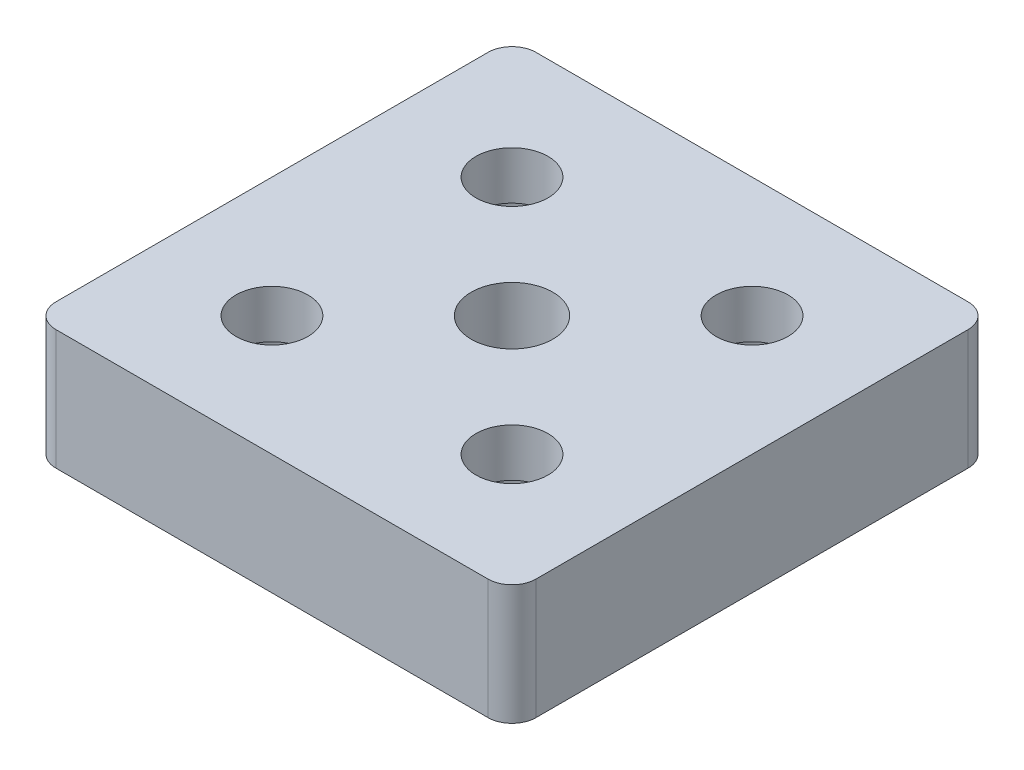
from build123d import *

# Parameters (mm, degrees)
SKETCH_1_R             = 3
EXTRUDE_1_DEPTH        = 10
SKETCH_3_R             = 5.5
CUT_EXTRUDE_1_DEPTH    = 6
HOLE_WIZARD_M8_1_D     = 6.8
HOLE_WIZARD_M8_1_DEPTH = 38.75
HOLE_WIZARD_M8_1_TIP   = 2.042926105


with BuildPart() as part:
    # 草图1 → 凸台-拉伸1 (new body)
    with BuildSketch(Plane(origin=(0, 0, 0), x_dir=(1, 0, 0), z_dir=(0, 1, 0))):
        with BuildLine():
            Line((-18, 0), (18, 0))
            ThreePointArc((18, 0), (19.414213562, 0.585786438), (20, 2))
            Line((20, 2), (20, 38))
            ThreePointArc((20, 38), (19.414213562, 39.414213562), (18, 40))
            Line((18, 40), (-18, 40))
            ThreePointArc((-18, 40), (-19.414213562, 39.414213562), (-20, 38))
            Line((-20, 38), (-20, 2))
            ThreePointArc((-20, 2), (-19.414213562, 0.585786438), (-18, 0))
        make_face()
        with Locations(Location((10, 30, 0), (0, 0, 270))):
            Circle(SKETCH_1_R, mode=Mode.SUBTRACT)
        with Locations(Location((-10, 30, 0), (0, 0, 270))):
            Circle(SKETCH_1_R, mode=Mode.SUBTRACT)
        with Locations(Location((-10, 10, 0), (0, 0, 270))):
            Circle(SKETCH_1_R, mode=Mode.SUBTRACT)
        with Locations(Location((10, 10, 0), (0, 0, 270))):
            Circle(SKETCH_1_R, mode=Mode.SUBTRACT)
    extrude(amount=EXTRUDE_1_DEPTH)

    # 草图3 → 切除-拉伸1 (cut)
    with BuildSketch(Plane.XZ):
        with Locations(Location((-10, -10, 0), (0, 0, 270))):
            Circle(SKETCH_3_R)
        with Locations(Location((10, -10, 0), (0, 0, 270))):
            Circle(SKETCH_3_R)
        with Locations(Location((10, -30, 0), (0, 0, 270))):
            Circle(SKETCH_3_R)
        with Locations(Location((-10, -30, 0), (0, 0, 270))):
            Circle(SKETCH_3_R)
    extrude(amount=-CUT_EXTRUDE_1_DEPTH, mode=Mode.SUBTRACT)

    # M8 螺纹孔1
    with Locations(Plane(origin=(0, 10, -20), x_dir=(0, 0, 1), z_dir=(0, 1, 0))):
        with Locations((0, 0)):
            Hole(HOLE_WIZARD_M8_1_D / 2, depth=HOLE_WIZARD_M8_1_DEPTH)
            with Locations((0, 0, -(HOLE_WIZARD_M8_1_DEPTH + HOLE_WIZARD_M8_1_TIP / 2))):  # 118° drill point
                Cone(0, HOLE_WIZARD_M8_1_D / 2, HOLE_WIZARD_M8_1_TIP, mode=Mode.SUBTRACT)


solid = part.part
